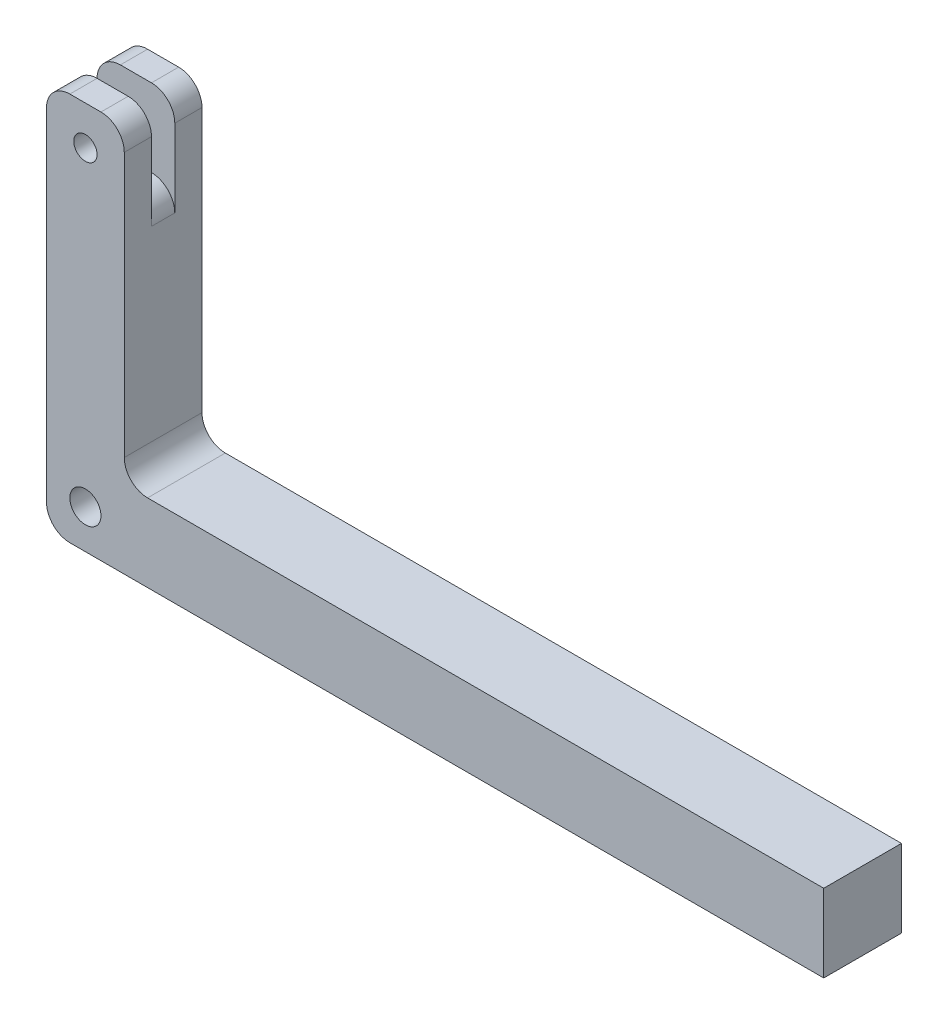
from build123d import *

# Parameters (mm, degrees)
SKETCH1_R             = 2
BOSS_EXTRUDE1_DEPTH   = 10
SKETCH2_W             = 10
SKETCH2_H             = 3
CUT_EXTRUDE1_DEPTH    = 10
F_3_0MM_DOWEL_HOLE1_D = 3
FILLET2_R             = 3


with BuildPart() as part:
    # Sketch1 → Boss-Extrude1 (new body)
    with BuildSketch(Plane.XY):
        Polygon((0, 0), (100, 0), (100, 10), (10, 10), (10, 50), (0, 50), align=None)
        with Locations((5, 5)):
            Circle(SKETCH1_R, mode=Mode.SUBTRACT)
    extrude(amount=BOSS_EXTRUDE1_DEPTH)

    # Sketch2 → Cut-Extrude1 (cut)
    with BuildSketch(Plane(origin=(0, 50, 0), x_dir=(1, 0, 0), z_dir=(0, 1, 0))):
        with Locations((5, -5)):
            Rectangle(SKETCH2_W, SKETCH2_H)
    extrude(amount=-CUT_EXTRUDE1_DEPTH, mode=Mode.SUBTRACT)

    # Ø3.0mm Dowel Hole1 (through all)
    with Locations(Plane(origin=(0, 0, 0), x_dir=(1, 0, 0), z_dir=(0, 0, -1))):
        with Locations((5, -45)):
            Hole(F_3_0MM_DOWEL_HOLE1_D / 2)

    # Fillet2
    fillet2_edges = [part.edges().sort_by_distance(p)[0] for p in [
        (0, 50, 8.25),
        (10, 50, 8.25),
        (10, 10, 5),
        (0, 0, 5),
        (0, 50, 1.75),
        (10, 50, 1.75),
        (0, 40, 5),
        (10, 40, 5),
    ]]
    fillet(fillet2_edges, radius=FILLET2_R)


solid = part.part
